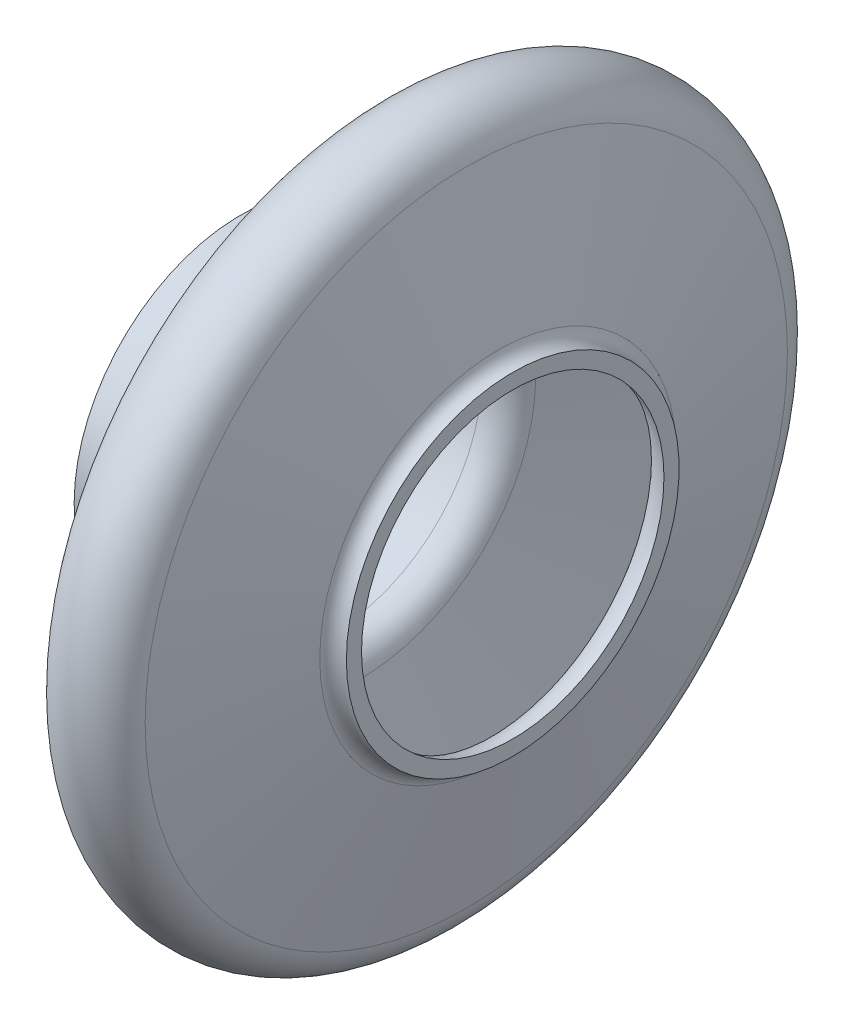
from build123d import *


with BuildPart() as part:
    # Sketch2 → Revolve-Thin7 (revolve)
    with BuildSketch(Plane(origin=(0, 0, 0), x_dir=(1, 0, 0), z_dir=(0, 1, 0)), mode=Mode.PRIVATE) as revolve_thin7_sk:
        with BuildLine():
            ThreePointArc((-54, 10), (-55.251846944, 10.440231034), (-55.952592014, 11.567120772))
            Line((-55.952592014, 11.567120772), (-58.047407986, 21.016224988))
            ThreePointArc((-58.047407986, 21.016224988), (-60, 22.583345761), (-61.952592014, 21.016224988))
            Line((-61.952592014, 21.016224988), (-64.047407986, 11.567120772))
            ThreePointArc((-64.047407986, 11.567120772), (-64.748153056, 10.440231034), (-66, 10))
            Line((-66, 10), (-72, 10))
            Line((-72, 10), (-72, 11))
            Line((-72, 11), (-66, 11))
            ThreePointArc((-66, 11), (-65.374076528, 11.220115517), (-65.023703993, 11.783560386))
            Line((-65.023703993, 11.783560386), (-62.928888021, 21.232664602))
            ThreePointArc((-62.928888021, 21.232664602), (-60, 23.583345761), (-57.071111979, 21.232664602))
            Line((-57.071111979, 21.232664602), (-54.976296007, 11.783560386))
            ThreePointArc((-54.976296007, 11.783560386), (-54.625923472, 11.220115517), (-54, 11))
            Line((-54, 11), (-54, 10))
        make_face()
    revolve(revolve_thin7_sk.sketch.rotate(Axis((0, 0, 0), (1, 0, 0)), 180), axis=Axis((0, 0, 0), (1, 0, 0)))


solid = part.part
